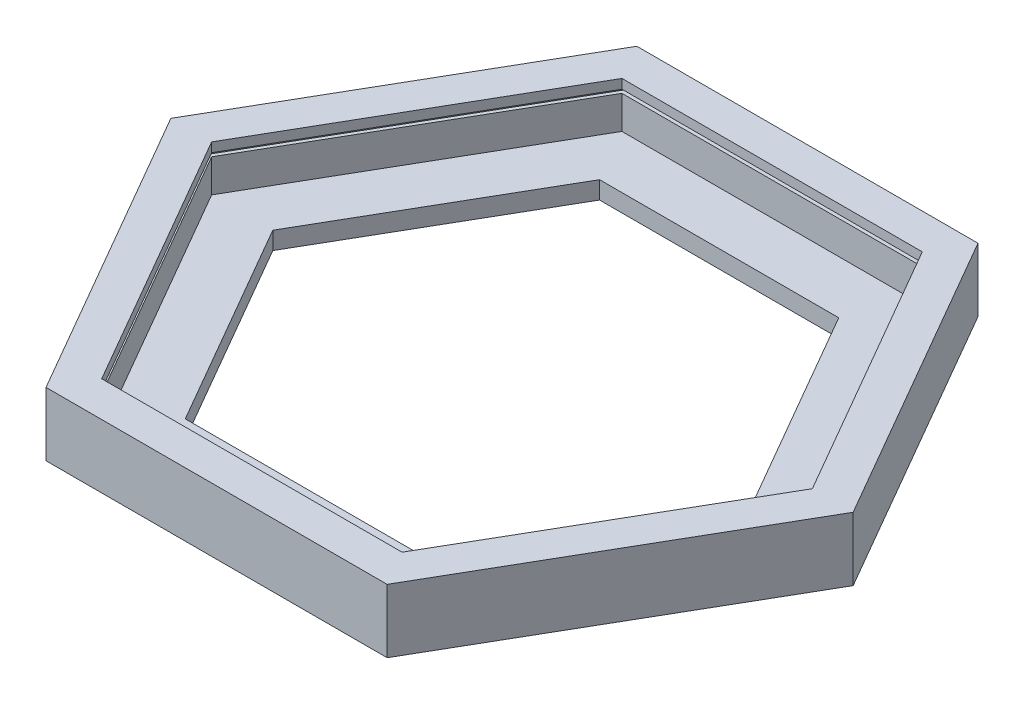
from build123d import *

# Parameters (mm, degrees)
BASE_HEXAGON_DEPTH = 5
OUTER_WALL_DEPTH   = 18
FILL_LINE_DEPTH    = 1


with BuildPart() as part:
    # Profiles Sketch → Base Hexagon (new body)
    with BuildSketch(Plane(origin=(0, 0, 0), x_dir=(1, 0, 0), z_dir=(0, 1, 0))):
        Polygon((-96.599564284, 0), (-48.299782142, -83.657676664), (48.299782142, -83.657676664), (96.599564284, 0), (48.299782142, 83.657676664), (-48.299782142, 83.657676664), align=None)
        Polygon((-33.866025412, 58.657676664), (33.866025412, 58.657676664), (67.732050824, 0), (33.866025412, -58.657676664), (-33.866025412, -58.657676664), (-67.732050824, 0), align=None, mode=Mode.SUBTRACT)
    extrude(amount=BASE_HEXAGON_DEPTH)

    # Sketch1<3> → Outer Wall (add)
    with BuildSketch(Plane(origin=(0, 0, 0), x_dir=(1, 0, 0), z_dir=(0, 1, 0))):
        Polygon((-96.599564284, 0), (-48.299782142, -83.657676664), (48.299782142, -83.657676664), (96.599564284, 0), (48.299782142, 83.657676664), (-48.299782142, 83.657676664), align=None)
        Polygon((42.52627945, -73.657676664), (-42.52627945, -73.657676664), (-85.0525589, 0), (-42.52627945, 73.657676664), (42.52627945, 73.657676664), (85.0525589, 0), align=None, mode=Mode.SUBTRACT)
    extrude(amount=OUTER_WALL_DEPTH)

    # Fill Line Sketch → Fill Line (cut)
    with BuildSketch(Plane(origin=(0, 14.35, 0), x_dir=(1, 0, 0), z_dir=(0, 1, 0))):
        Polygon((86.207259438, 0), (43.103629719, 74.657676664), (-43.103629719, 74.657676664), (-86.207259438, 0), (-43.103629719, -74.657676664), (43.103629719, -74.657676664), align=None)
        Polygon((85.0525589, 0), (42.52627945, 73.657676664), (-42.52627945, 73.657676664), (-85.0525589, 0), (-42.52627945, -73.657676664), (42.52627945, -73.657676664), align=None, mode=Mode.SUBTRACT)
    extrude(amount=FILL_LINE_DEPTH, mode=Mode.SUBTRACT)


solid = part.part
